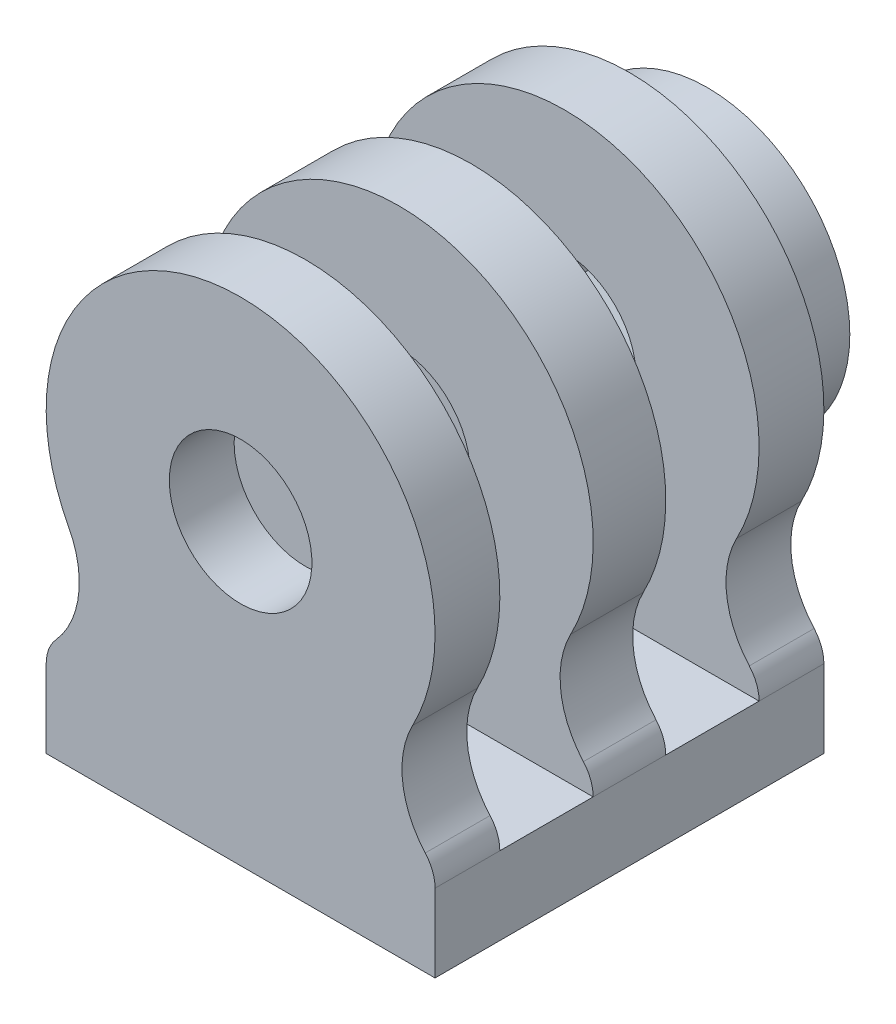
from build123d import *

# Parameters (mm, degrees)
SKETCH1_W               = 15
SKETCH1_H               = 7.5
BOSS_EXTRUDE_BASE_DEPTH = 3
SKETCH2_W               = 15
SKETCH2_H               = 2.5
SKETCH2_H_2             = 1.4
BOSS_EXTRUDE2_DEPTH     = 16
CUT_EXTRUDE1_DEPTH      = 26.342651795
SKETCH6_R               = 2.75
CUT_EXTRUDE_HOLE_DEPTH  = 26.342651795
SKETCH7_R               = 5.5
BOSS_EXTRUDE4_DEPTH     = 3
CUT_EXTRUDE4_DEPTH      = 3


with BuildPart() as part:
    # Sketch1 → Boss-Extrude - Base (new body)
    with BuildSketch(Plane(origin=(0, 0, 0), x_dir=(1, 0, 0), z_dir=(0, 1, 0))):
        with Locations((7.5, 3.75)):
            Rectangle(SKETCH1_W, SKETCH1_H)
    extrude(amount=BOSS_EXTRUDE_BASE_DEPTH)

    # Sketch2 → Boss-Extrude2 (add)
    with BuildSketch(Plane(origin=(0, 3, 0), x_dir=(1, 0, 0), z_dir=(0, 1, 0))):
        with Locations((7.5, 6.25)):
            Rectangle(SKETCH2_W, SKETCH2_H)
        with Locations((7.5, 0.7)):
            Rectangle(SKETCH2_W, SKETCH2_H_2)
    extrude(amount=BOSS_EXTRUDE2_DEPTH)

    # Sketch4 → Cut-Extrude1 (cut, through all)
    with BuildSketch(Plane(origin=(0, 0, -7.5), x_dir=(-1, 0, 0), z_dir=(0, 0, -1))):
        with BuildLine():
            Line((0, 3), (3.144969959, 3))
            Line((3.144969959, 3), (3.144969959, 20.655431795))
            Line((3.144969959, 20.655431795), (-18.154935256, 20.655431795))
            Line((-18.154935256, 20.655431795), (-18.154935256, 3))
            Line((-18.154935256, 3), (-15, 3))
            ThreePointArc((-15, 3), (-14.902566102, 3.529038543), (-14.623050239, 3.988653628))
            ThreePointArc((-14.623050239, 3.988653628), (-13.75, 5.91762732), (-14.133249581, 8))
            ThreePointArc((-14.133249581, 8), (-7.5, 19), (-0.866750419, 8))
            ThreePointArc((-0.866750419, 8), (-1.25, 5.91762732), (-0.376949761, 3.988653628))
            ThreePointArc((-0.376949761, 3.988653628), (-0.097433898, 3.529038543), (0, 3))
        make_face()
    extrude(amount=-CUT_EXTRUDE1_DEPTH, mode=Mode.SUBTRACT)

    # Sketch6 → Cut-Extrude - Hole (cut, through all)
    with BuildSketch(Plane(origin=(0, 0, -7.5), x_dir=(-1, 0, 0), z_dir=(0, 0, -1))):
        with Locations((-7.5, 11.5)):
            Circle(SKETCH6_R)
    extrude(amount=-CUT_EXTRUDE_HOLE_DEPTH, mode=Mode.SUBTRACT)

    # Mirror1: part across plane


with BuildPart() as part_1:
    add(part.part)
    add(part.part.mirror(Plane(origin=(0, 3, 0), x_dir=(1, 0, 0), z_dir=(0, 0, -1))))

    # Sketch7 → Boss-Extrude4 (add)
    with BuildSketch(Plane(origin=(0, 0, -7.5), x_dir=(-1, 0, 0), z_dir=(0, 0, -1))):
        with Locations((-7.5, 11.5)):
            Circle(SKETCH7_R)
    extrude(amount=BOSS_EXTRUDE4_DEPTH)

    # Sketch8 → Cut-Extrude4 (cut)
    with BuildSketch(Plane(origin=(0, 0, -10.5), x_dir=(-1, 0, 0), z_dir=(0, 0, -1))):
        Polygon((-3.5, 9.190598923), (-3.5, 13.809401077), (-7.5, 16.118802154), (-11.5, 13.809401077), (-11.5, 9.190598923), (-7.5, 6.881197846), align=None)
    extrude(amount=-CUT_EXTRUDE4_DEPTH, mode=Mode.SUBTRACT)


solid = part_1.part
